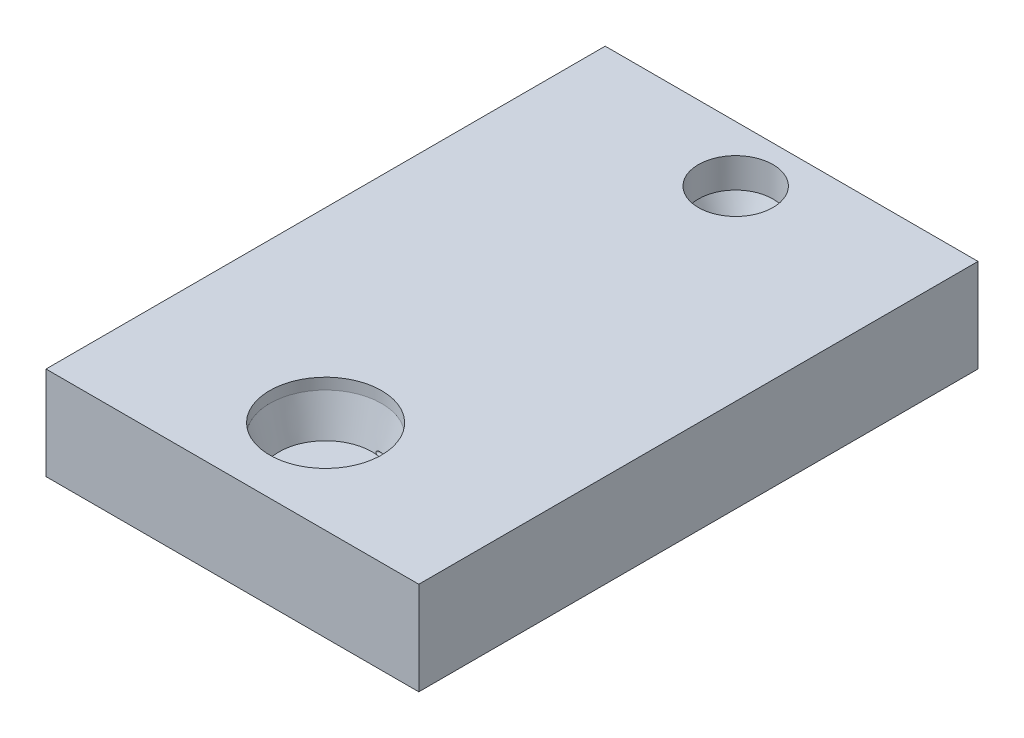
from build123d import *
from build123d.topology import SkipClean

# Parameters (mm, degrees)
SKETCH1_W           = 40
SKETCH1_H           = 10
BOSS_EXTRUDE1_DEPTH = 60
SKETCH10_R          = 0.2


with BuildPart() as part:
    # Sketch1 → Boss-Extrude1 (new body)
    with BuildSketch(Plane.XY):
        Rectangle(SKETCH1_W, SKETCH1_H)
    extrude(amount=BOSS_EXTRUDE1_DEPTH)

    # Cut-Sweep1: sweep along a path in Sketch2
    with BuildLine(Plane(origin=(0, 0, 0), x_dir=(1, 0, 0), z_dir=(0, 1, 0))) as cut_sweep1_path:
        Line((0, -50), (0, -46))
        ThreePointArc((0, -46), (0.292893219, -45.292893219), (1, -45))
        Line((1, -45), (15, -45))
        ThreePointArc((15, -45), (16.5, -43.5), (15, -42))
        Line((15, -42), (0, -42))
        Line((0, -42), (-15, -42))
        ThreePointArc((-15, -42), (-16.5, -40.5), (-15, -39))
        Line((-15, -39), (15, -39))
        ThreePointArc((15, -39), (16.5, -37.5), (15, -36))
        Line((15, -36), (-15, -36))
        ThreePointArc((-15, -36), (-16.5, -34.5), (-15, -33))
        Line((-15, -33), (15.355579664, -33))
        ThreePointArc((15.355579664, -33), (16.855579664, -31.5), (15.355579664, -30))
        Line((15.355579664, -30), (-15, -30))
        ThreePointArc((-15, -30), (-16.5, -28.5), (-15, -27))
        Line((-15, -27), (15, -27))
        ThreePointArc((15, -27), (16.5, -25.5), (15, -24))
        Line((15, -24), (-15, -24))
        ThreePointArc((-15, -24), (-16.5, -22.5), (-15, -21))
        Line((-15, -21), (15, -21))
        ThreePointArc((15, -21), (16.5, -19.5), (15, -18))
        Line((15, -18), (-15, -18))
        ThreePointArc((-15, -18), (-16.5, -16.5), (-15, -15))
        Line((-15, -15), (15, -15))
        ThreePointArc((15, -15), (16.5, -13.5), (15, -12))
        Line((15, -12), (1, -12))
        ThreePointArc((1, -12), (0.292893219, -11.707106781), (0, -11))
        Line((0, -11), (0, -6))
    # Sketch10 → Cut-Sweep1 (sweep, cut)
    with BuildSketch(Plane(origin=(0, 0, 6), x_dir=(-1, 0, 0), z_dir=(0, 0, -1))):
        Circle(SKETCH10_R)
    sweep(path=cut_sweep1_path.line, mode=Mode.SUBTRACT)

    # Sketch13 → Cut-Revolve1 (revolve, cut)
    with SkipClean():  # the faces are left unmerged after this step: merging them gives an invalid solid
        with BuildSketch(Plane(origin=(0, 0, 0), x_dir=(0, 0, -1), z_dir=(1, 0, 0)), mode=Mode.PRIVATE) as cut_revolve1_sk:
            Polygon((-50, -0.2), (-55, -0.2), (-56, 3.8), (-56, 29.8), (-50, 29.8), align=None)
        revolve(cut_revolve1_sk.sketch.rotate(Axis((0, -0.2, 50), (0, 1, 0)), 168.477031497), axis=Axis((0, -0.2, 50), (0, 1, 0)), mode=Mode.SUBTRACT)

    # Sketch14 → Cut-Revolve2 (revolve, cut)
    with SkipClean():  # the faces are left unmerged after this step: merging them gives an invalid solid
        with BuildSketch(Plane(origin=(0, 0, 0), x_dir=(0, 0, -1), z_dir=(1, 0, 0)), mode=Mode.PRIVATE) as cut_revolve2_sk:
            Polygon((-6, -0.2), (-3, -0.2), (-2, 1.8), (-2, 29.8), (-6, 29.8), align=None)
        revolve(cut_revolve2_sk.sketch.rotate(Axis((0, -0.2, 6), (0, 1, 0)), 180), axis=Axis((0, -0.2, 6), (0, 1, 0)), mode=Mode.SUBTRACT)


solid = part.part
